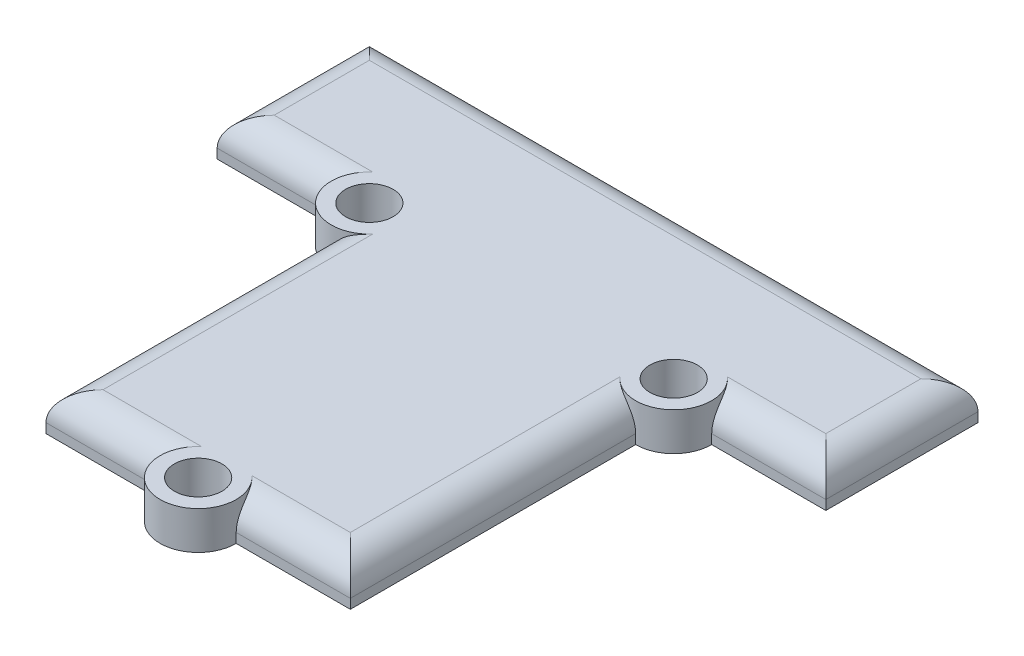
from build123d import *

# Parameters (mm, degrees)
ESQUISSE1_W             = 32
ESQUISSE1_H             = 8
BOSS_EXTRU_1_DEPTH      = 2
BOSS_EXTRU_2_DEPTH      = 2
ESQUISSE3_R             = 1.9999999999999996
ESQUISSE3_R_2           = 2.000000000000003
ESQUISSE3_R_3           = 1.9999999999999991
BOSS_EXTRU_3_DEPTH      = 2
ESQUISSE4_R             = 1.2499999999999991
ESQUISSE4_R_2           = 1.250000000000001
ESQUISSE4_R_3           = 1.2500000000000013
ENL_V_MAT_EXTRU_1_DEPTH = 2
CONG_1_R                = 1.5


with BuildPart() as part:
    # Esquisse1 → Boss.-Extru.1 (new body)
    with BuildSketch(Plane(origin=(0, 0, 0), x_dir=(1, 0, 0), z_dir=(0, 1, 0))):
        with Locations((16, 4)):
            Rectangle(ESQUISSE1_W, ESQUISSE1_H)
    extrude(amount=BOSS_EXTRU_1_DEPTH)

    # Esquisse2 → Boss.-Extru.2 (add)
    with BuildSketch(Plane(origin=(0, 2, 0), x_dir=(1, 0, 0), z_dir=(0, 1, 0))):
        Polygon((8.000000000000002, 4.5e-16), (24, 2.41e-15), (24.000000000000004, -17), (8.000000000000004, -17), align=None)
    extrude(amount=-BOSS_EXTRU_2_DEPTH)

    # Esquisse3 → Boss.-Extru.3 (add)
    with BuildSketch(Plane(origin=(0, 2, 0), x_dir=(1, 0, 0), z_dir=(0, 1, 0))):
        with Locations((8.000000000000002, 0)):
            Circle(ESQUISSE3_R)
        with Locations((24, 2.41e-15)):
            Circle(ESQUISSE3_R_2)
        with Locations((16.000000000000004, -17)):
            Circle(ESQUISSE3_R_3)
    extrude(amount=-BOSS_EXTRU_3_DEPTH)

    # Esquisse4 → Enlèv. mat.-Extru.1 (cut)
    with BuildSketch(Plane(origin=(0, 2, 0), x_dir=(1, 0, 0), z_dir=(0, 1, 0))):
        with Locations(Location((8.000000000000002, 0, 0), (0, 0, 270))):
            Circle(ESQUISSE4_R)
        with Locations(Location((24, 2.41e-15, 0), (0, 0, 270))):
            Circle(ESQUISSE4_R_2)
        with Locations(Location((16.000000000000004, -17, 0), (0, 0, 270))):
            Circle(ESQUISSE4_R_3)
    extrude(amount=-ENL_V_MAT_EXTRU_1_DEPTH, mode=Mode.SUBTRACT)

    # Congé1
    cong_1_edges = [part.edges().sort_by_distance(p)[0] for p in [
        (32, 2, -4),
        (16, 2, -8),
        (11.000000000000004, 2, 17),
        (24.000000000000004, 2, 9.500000000000002),
        (8.000000000000004, 2, 9.5),
        (29, 2, 0),
        (0, 2, -4),
        (21.000000000000004, 2, 17),
        (3.000000000000001, 2, 0),
    ]]
    fillet(cong_1_edges, radius=CONG_1_R)


solid = part.part
